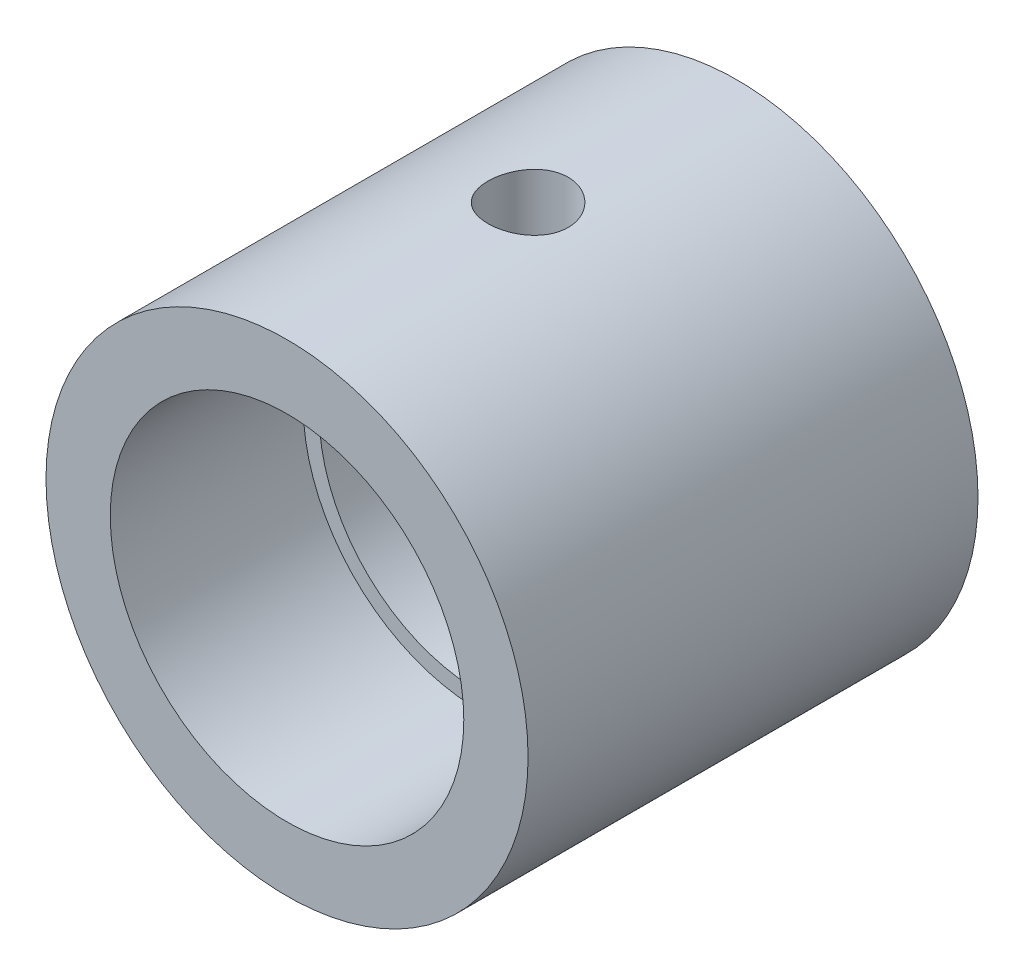
from build123d import *

# Parameters (mm, degrees)
SKETCH1_R                               = 15
BOSS_EXTRUDE1_DEPTH                     = 27
CBORE_FOR_M6_HEX_HEAD_BOLT1_D           = 20
CBORE_FOR_M6_HEX_HEAD_BOLT1_CBORE_D     = 22
CBORE_FOR_M6_HEX_HEAD_BOLT1_CBORE_DEPTH = 12
BOSS_EXTRUDE2_START                     = 1
SKETCH5_R                               = 15
BOSS_EXTRUDE2_DEPTH                     = 1
CUT_EXTRUDE1_DEPTH                      = 35.336569427
CUT_EXTRUDE1_DEPTH_BACK                 = 35.336569427
SKETCH4_R                               = 2.5


with BuildPart() as part:
    # Sketch1 → Boss-Extrude1 (new body)
    with BuildSketch(Plane.XY):
        Circle(SKETCH1_R)
    extrude(amount=BOSS_EXTRUDE1_DEPTH)

    # CBORE for M6 Hex Head Bolt1 (through all)
    with Locations(Plane.XY.offset(27)):
        with Locations((0, 0)):
            CounterBoreHole(CBORE_FOR_M6_HEX_HEAD_BOLT1_D / 2, CBORE_FOR_M6_HEX_HEAD_BOLT1_CBORE_D / 2, CBORE_FOR_M6_HEX_HEAD_BOLT1_CBORE_DEPTH)

    # Sketch5 → Boss-Extrude2 (add)
    with BuildSketch(Plane(origin=(0, 0, 0), x_dir=(-1, 0, 0), z_dir=(0, 0, -1)).offset(BOSS_EXTRUDE2_START)):
        Circle(SKETCH5_R)
    extrude(amount=-BOSS_EXTRUDE2_DEPTH)

    # Sketch4 → Cut-Extrude1 (cut, two sides: drawn at the far end of the back side and taken through both)
    with BuildSketch(Plane(origin=(0, 0, 0), x_dir=(1, 0, 0), z_dir=(0, 1, 0)).offset(-CUT_EXTRUDE1_DEPTH_BACK)):
        with Locations(Location((0, -12, 0), (0, 0, 270))):
            Circle(SKETCH4_R)
    extrude(amount=CUT_EXTRUDE1_DEPTH + CUT_EXTRUDE1_DEPTH_BACK, mode=Mode.SUBTRACT)


solid = part.part
